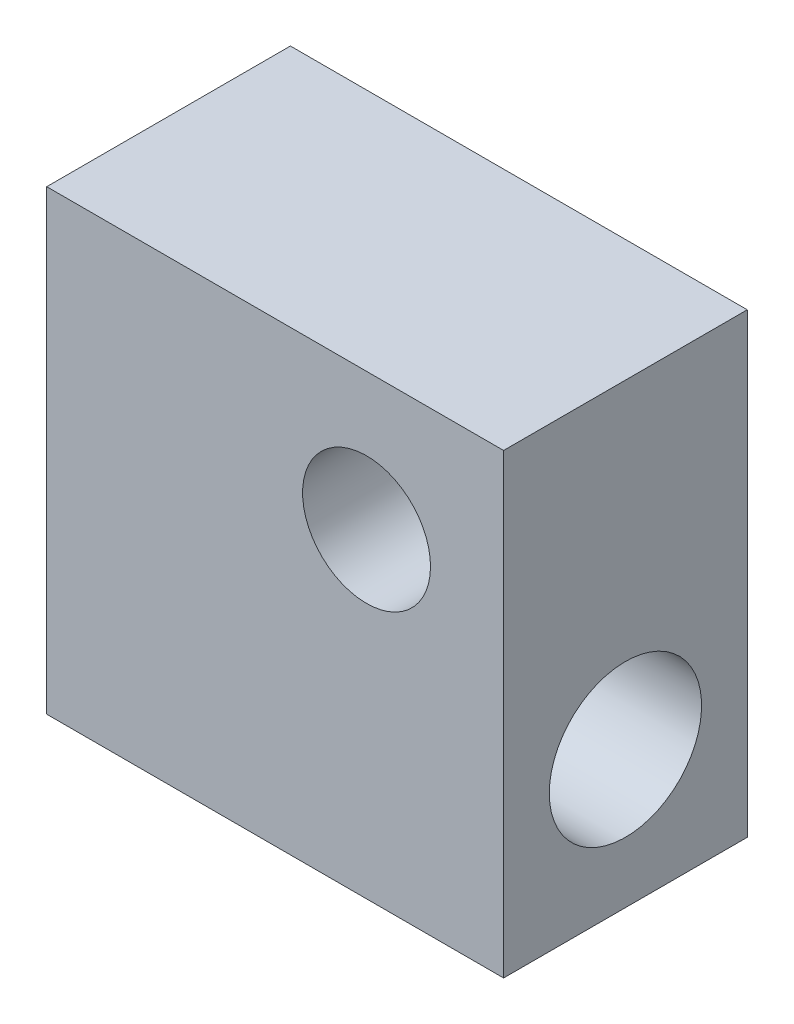
from build123d import *

# Parameters (mm, degrees)
SKETCH1_W                   = 15
SKETCH1_H                   = 15
BOSS_EXTRUDE1_DEPTH         = 8
TAP_DRILL_FOR_M5X0_8_TAP1_D = 4.2
F_5_0_5_DIAMETER_HOLE1_D    = 5


with BuildPart() as part:
    # Sketch1 → Boss-Extrude1 (new body)
    with BuildSketch(Plane.XY):
        with Locations((7.5, 7.5)):
            Rectangle(SKETCH1_W, SKETCH1_H)
    extrude(amount=BOSS_EXTRUDE1_DEPTH)

    # Tap Drill for M5x0.8 Tap1 (through all)
    with Locations(Plane.XY.offset(8)):
        with Locations((10.5, 10.5)):
            Hole(TAP_DRILL_FOR_M5X0_8_TAP1_D / 2)

    # Ø5.0 (5) Diameter Hole1 (through all)
    with Locations(Plane.ZY):
        with Locations((4, 4.5)):
            Hole(F_5_0_5_DIAMETER_HOLE1_D / 2)


solid = part.part
